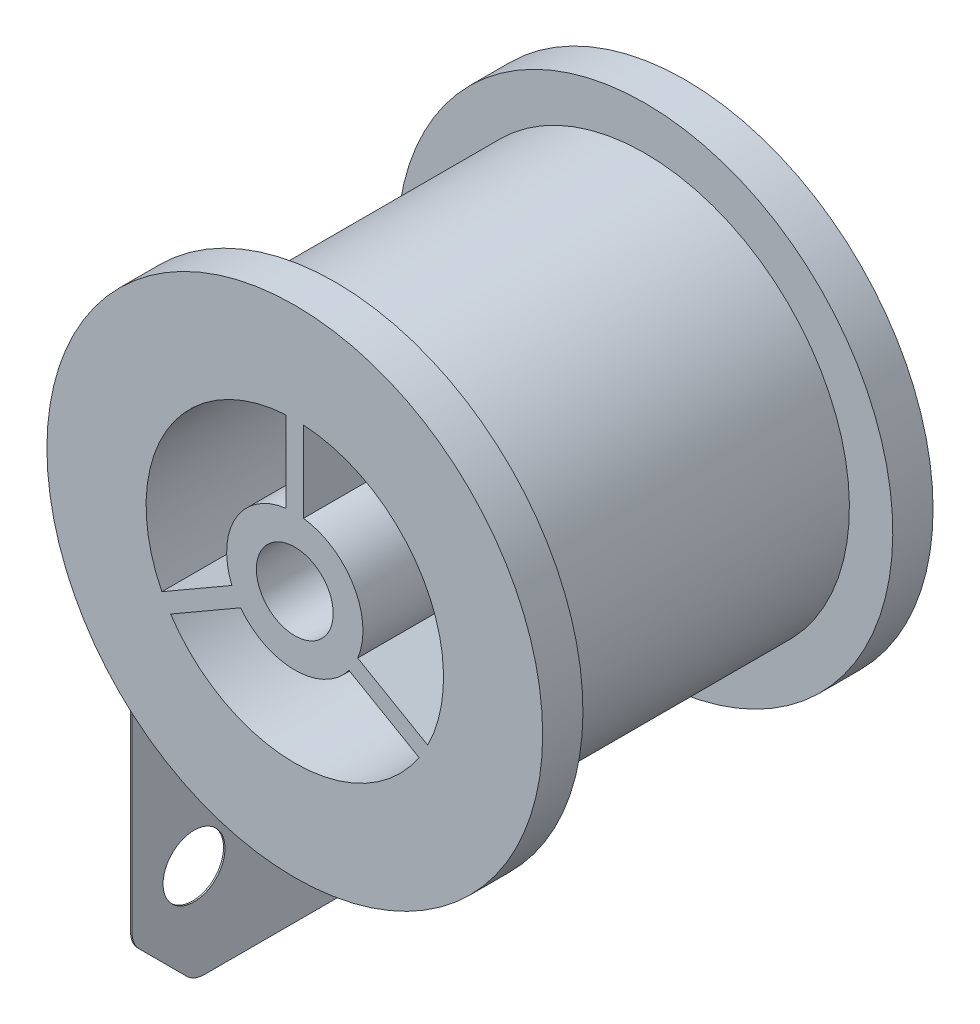
from build123d import *

# Parameters (mm, degrees)
CUT_EXTRUDE_1_DEPTH = 14.7
SKETCH_4_W          = 25
SKETCH_4_H          = 39.508434057
SKETCH_4_R          = 2.5
EXTRUDE_1_DEPTH     = 0.12
CHAMFER_1_SIZE      = 5
FILLET_1_R          = 2


with BuildPart() as part:
    # 草图2 → 旋转1 (revolve)
    with BuildSketch(Plane(origin=(0, 0, 0), x_dir=(1, 0, 0), z_dir=(0, 1, 0)), mode=Mode.PRIVATE) as revolve_1_sk:
        Polygon((3.1, 15.75), (20, 15.75), (20, 12.5), (16.5, 12.5), (16.5, -12.5), (20, -12.5), (20, -15.75), (3.1, -15.75), align=None)
    revolve(revolve_1_sk.sketch.rotate(Axis((0, 0, -15.75), (0, 0, 1)), 180), axis=Axis((0, 0, -15.75), (0, 0, 1)))

    # 草图3 → 切除-拉伸1 (cut)
    with BuildSketch(Plane.XY.offset(15.75)):
        with BuildLine():
            Line((-0.7, 5.455272679), (-0.7, 11.979565935))
            ThreePointArc((-0.7, 11.979565935), (-10.392304845, 6), (-10.724608426, -5.383565185))
            Line((-10.724608426, -5.383565185), (-5.074404724, -2.121418557))
            ThreePointArc((-5.074404724, -2.121418557), (-4.763139721, 2.75), (-0.7, 5.455272679))
        make_face()
        with BuildLine():
            Line((-4.374404724, -3.333854122), (-10.024608426, -6.59600075))
            ThreePointArc((-10.024608426, -6.59600075), (0, -12), (10.024608426, -6.59600075))
            Line((10.024608426, -6.59600075), (4.374404724, -3.333854122))
            ThreePointArc((4.374404724, -3.333854122), (0, -5.5), (-4.374404724, -3.333854122))
        make_face()
        with BuildLine():
            ThreePointArc((12, 0), (8.729261137, 8.23407554), (0.7, 11.979565935))
            Line((0.7, 11.979565935), (0.7, 5.455272679))
            ThreePointArc((0.7, 5.455272679), (4.129164564, 3.633180425), (5.5, 0))
            ThreePointArc((5.5, 0), (5.392551622, -1.081844262), (5.074404724, -2.121418557))
            Line((5.074404724, -2.121418557), (10.724608426, -5.383565185))
            ThreePointArc((10.724608426, -5.383565185), (11.676799671, -2.766288026), (12, 0))
        make_face()
    cut_extrude_1 = extrude(amount=-CUT_EXTRUDE_1_DEPTH, mode=Mode.SUBTRACT)

    # 镜向2: 切除-拉伸1 across plane
    add(cut_extrude_1.mirror(Plane.XY), mode=Mode.SUBTRACT)

    # 草图4 → 凸台-拉伸1 (add)
    with BuildSketch(Plane.ZY.offset(16.5)):
        with Locations((0, -19.754217029)):
            Rectangle(SKETCH_4_W, SKETCH_4_H)
        with Locations((7.5, -31.508434057)):
            Circle(SKETCH_4_R, mode=Mode.SUBTRACT)
        with Locations((-7.5, -31.508434057)):
            Circle(SKETCH_4_R, mode=Mode.SUBTRACT)
    extrude(amount=-EXTRUDE_1_DEPTH)

    # 倒角1
    chamfer_1_edges = [part.edges().sort_by_distance(p)[0] for p in [
        (-16.44, -39.508434057, 12.5),
        (-16.44, -39.508434057, -12.5),
    ]]
    chamfer(chamfer_1_edges, length=CHAMFER_1_SIZE)

    # 圆角1
    fillet_1_edges = [part.edges().sort_by_distance(p)[0] for p in [
        (-16.44, -34.508434057, -12.5),
        (-16.44, -39.508434057, 7.5),
        (-16.44, -39.508434057, -7.5),
        (-16.44, -34.508434057, 12.5),
    ]]
    fillet(fillet_1_edges, radius=FILLET_1_R)


solid = part.part
